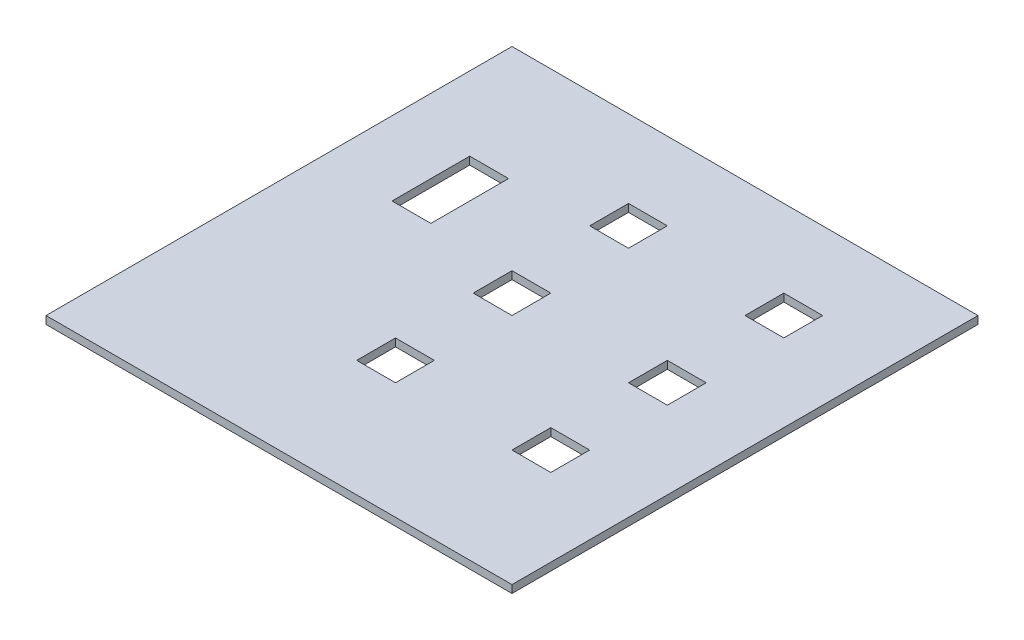
from build123d import *

# Parameters (mm, degrees)
SKETCH1_W            = 304.8
SKETCH1_H            = 304.8
BOSS_EXTRUDE1_DEPTH  = 5.08
SKETCH2_W            = 25.4
SKETCH2_H            = 25.4
CUT_EXTRUDE1_DEPTH   = 5.08
LPATTERN1_COUNT      = 3
LPATTERN1_PITCH      = 76.2
LPATTERN1_COUNT_DIR2 = 2
LPATTERN1_PITCH_DIR2 = 101.6
SKETCH3_W            = 25.4
SKETCH3_H            = 50.8
CUT_EXTRUDE2_DEPTH   = 7.62


with BuildPart() as part:
    # Sketch1 → Boss-Extrude1 (new body)
    with BuildSketch(Plane(origin=(0, 0, 0), x_dir=(1, 0, 0), z_dir=(0, 1, 0))):
        Rectangle(SKETCH1_W, SKETCH1_H)
    extrude(amount=BOSS_EXTRUDE1_DEPTH)

    # Sketch2 → Cut-Extrude1 (cut)
    with BuildSketch(Plane(origin=(0, 5.08, 0), x_dir=(1, 0, 0), z_dir=(0, 1, 0))):
        with Locations((-12.7, 88.9)):
            Rectangle(SKETCH2_W, SKETCH2_H)
    cut_extrude1 = extrude(amount=-CUT_EXTRUDE1_DEPTH, mode=Mode.SUBTRACT)

    # LPattern1: Cut-Extrude1 3 × 2
    with Locations(*[(j * LPATTERN1_PITCH_DIR2, 0, i * LPATTERN1_PITCH) for i in range(LPATTERN1_COUNT) for j in range(LPATTERN1_COUNT_DIR2) if (i, j) != (0, 0)]):
        add(cut_extrude1, mode=Mode.SUBTRACT)

    # Sketch3 → Cut-Extrude2 (cut)
    with BuildSketch(Plane(origin=(0, 5.08, 0), x_dir=(1, 0, 0), z_dir=(0, 1, 0))):
        with Locations((-91.407513773, 51.049523057)):
            Rectangle(SKETCH3_W, SKETCH3_H)
    extrude(amount=-CUT_EXTRUDE2_DEPTH, mode=Mode.SUBTRACT)


solid = part.part
